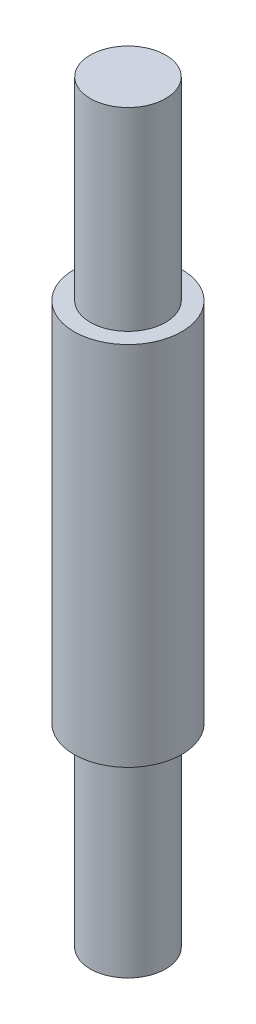
from build123d import *


with BuildPart() as part:
    # Sketch1 → Revolve1 (revolve)
    with BuildSketch(Plane.XY, mode=Mode.PRIVATE) as revolve1_sk:
        Polygon((-4.445, 0), (-4.445, 22.86), (-6.35, 22.86), (-6.35, 66.04), (-4.445, 66.04), (-4.445, 88.9), (0, 88.9), (0, 0), align=None)
    revolve(revolve1_sk.sketch.rotate(Axis((0, 88.9, 0), (0, -1, 0)), 270), axis=Axis((0, 88.9, 0), (0, -1, 0)))


solid = part.part
